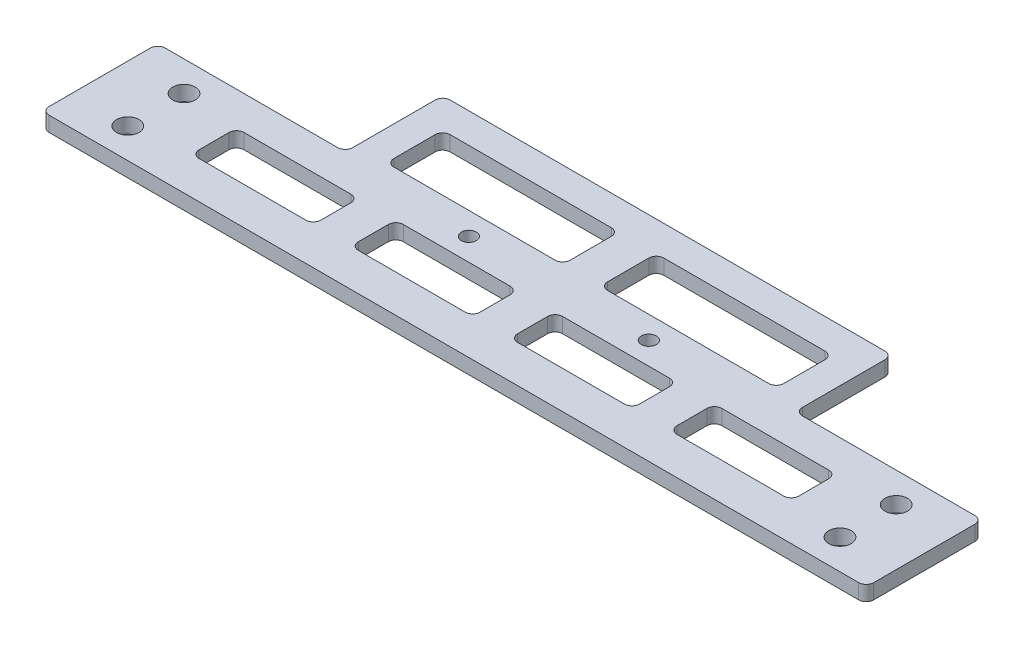
from build123d import *

# Parameters (mm, degrees)
SKETCH_1_R          = 1.5
SKETCH_1_R_2        = 1
EXTRUDE_1_DEPTH     = 2
SKETCH_2_W          = 16.25
SKETCH_2_H          = 6
SKETCH_2_W_2        = 23.5
SKETCH_2_H_2        = 7.5
CUT_EXTRUDE_1_DEPTH = 59.8180457
FILLET_1_R          = 1


with BuildPart() as part:
    # 草图1 → 凸台-拉伸1 (new body)
    with BuildSketch(Plane(origin=(0, 0, 0), x_dir=(1, 0, 0), z_dir=(0, 1, 0))):
        Polygon((30, 7.75), (55, 7.75), (55, -7.75), (-55, -7.75), (-55, 7.75), (-30, 7.75), (-30, 20.75), (30, 20.75), align=None)
        with Locations(Location((-47.5, 3.75, 0), (0, 0, 270))):
            Circle(SKETCH_1_R, mode=Mode.SUBTRACT)
        with Locations(Location((-47.5, -3.75, 0), (0, 0, 270))):
            Circle(SKETCH_1_R, mode=Mode.SUBTRACT)
        with Locations(Location((47.5, 3.75, 0), (0, 0, 270))):
            Circle(SKETCH_1_R, mode=Mode.SUBTRACT)
        with Locations(Location((47.5, -3.75, 0), (0, 0, 270))):
            Circle(SKETCH_1_R, mode=Mode.SUBTRACT)
        with Locations(Location((-12, 6.25, 0), (0, 0, 270))):
            Circle(SKETCH_1_R_2, mode=Mode.SUBTRACT)
        with Locations(Location((12, 6.25, 0), (0, 0, 270))):
            Circle(SKETCH_1_R_2, mode=Mode.SUBTRACT)
    extrude(amount=EXTRUDE_1_DEPTH)

    # 草图2 → 切除-拉伸1 (cut, through all)
    with BuildSketch(Plane(origin=(0, 2, 0), x_dir=(1, 0, 0), z_dir=(0, 1, 0))):
        with Locations((-31.875, 0.25)):
            Rectangle(SKETCH_2_W, SKETCH_2_H)
        with Locations((-10.625, 0.25)):
            Rectangle(SKETCH_2_W, SKETCH_2_H)
        with Locations((10.625, 0.25)):
            Rectangle(SKETCH_2_W, SKETCH_2_H)
        with Locations((31.875, 0.25)):
            Rectangle(SKETCH_2_W, SKETCH_2_H)
        with Locations((-14.25, 13)):
            Rectangle(SKETCH_2_W_2, SKETCH_2_H_2)
        with Locations((14.25, 13)):
            Rectangle(SKETCH_2_W_2, SKETCH_2_H_2)
    extrude(amount=-CUT_EXTRUDE_1_DEPTH, mode=Mode.SUBTRACT)

    # 圆角1
    fillet_1_edges = [part.edges().sort_by_distance(p)[0] for p in [
        (-40, 1, 2.75),
        (-40, 1, -3.25),
        (-23.75, 1, -3.25),
        (-23.75, 1, 2.75),
        (-55, 1, -7.75),
        (-30, 1, -7.75),
        (-30, 1, -20.75),
        (30, 1, -20.75),
        (30, 1, -7.75),
        (55, 1, -7.75),
        (55, 1, 7.75),
        (-55, 1, 7.75),
        (40, 1, 2.75),
        (23.75, 1, 2.75),
        (23.75, 1, -3.25),
        (40, 1, -3.25),
        (-26, 1, -9.25),
        (-26, 1, -16.75),
        (-2.5, 1, -16.75),
        (-2.5, 1, -9.25),
        (2.5, 1, -16.75),
        (26, 1, -16.75),
        (26, 1, -9.25),
        (2.5, 1, -9.25),
        (-18.75, 1, 2.75),
        (-18.75, 1, -3.25),
        (-2.5, 1, -3.25),
        (-2.5, 1, 2.75),
        (18.75, 1, -3.25),
        (18.75, 1, 2.75),
        (2.5, 1, 2.75),
        (2.5, 1, -3.25),
    ]]
    fillet(fillet_1_edges, radius=FILLET_1_R)


solid = part.part
